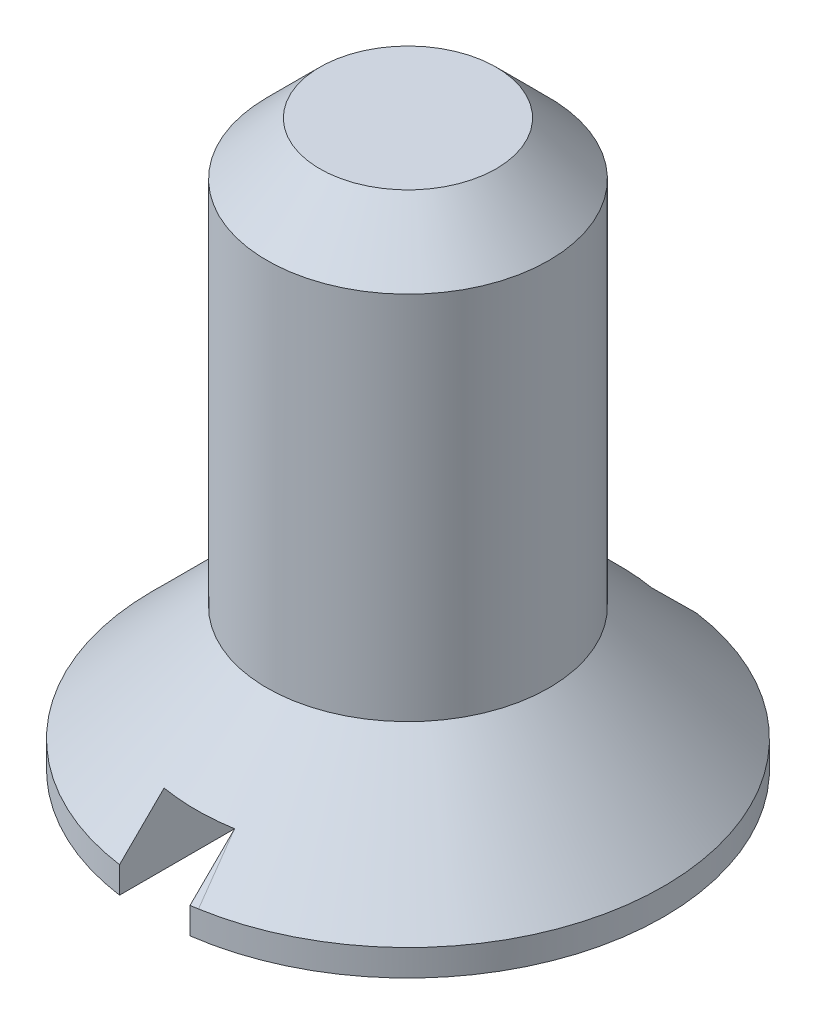
from build123d import *

# Parameters (mm, degrees)
SKETCH_1_W          = 4
SKETCH_1_H          = 12
SKETCH_2_W          = 2
SKETCH_2_H          = 2
CUT_EXTRUDE_1_DEPTH = 10
CHAMFER_1_SIZE      = 1.5


with BuildPart() as part:
    # Эскиз1 → Повернуть1 (revolve)
    with BuildSketch(Plane.XY):
        with Locations((-2, 10)):
            Rectangle(SKETCH_1_W, SKETCH_1_H)
        Polygon((-7.25, 0), (0, 0), (0, 4), (-4, 4), (-7.25, 0.75), align=None)
    revolve(axis=Axis((0, 16, 0), (0, -1, 0)))

    # Эскиз2 → Вырез-Вытянуть1 (cut, symmetric)
    with BuildSketch(Plane.XY):
        with Locations((0, 1)):
            Rectangle(SKETCH_2_W, SKETCH_2_H)
    extrude(amount=CUT_EXTRUDE_1_DEPTH, both=True, mode=Mode.SUBTRACT)

    # Фаска1
    chamfer_1_edges = [part.edges().sort_by_distance(p)[0] for p in [
        (4, 16, 0),
    ]]
    chamfer(chamfer_1_edges, length=CHAMFER_1_SIZE)


solid = part.part
